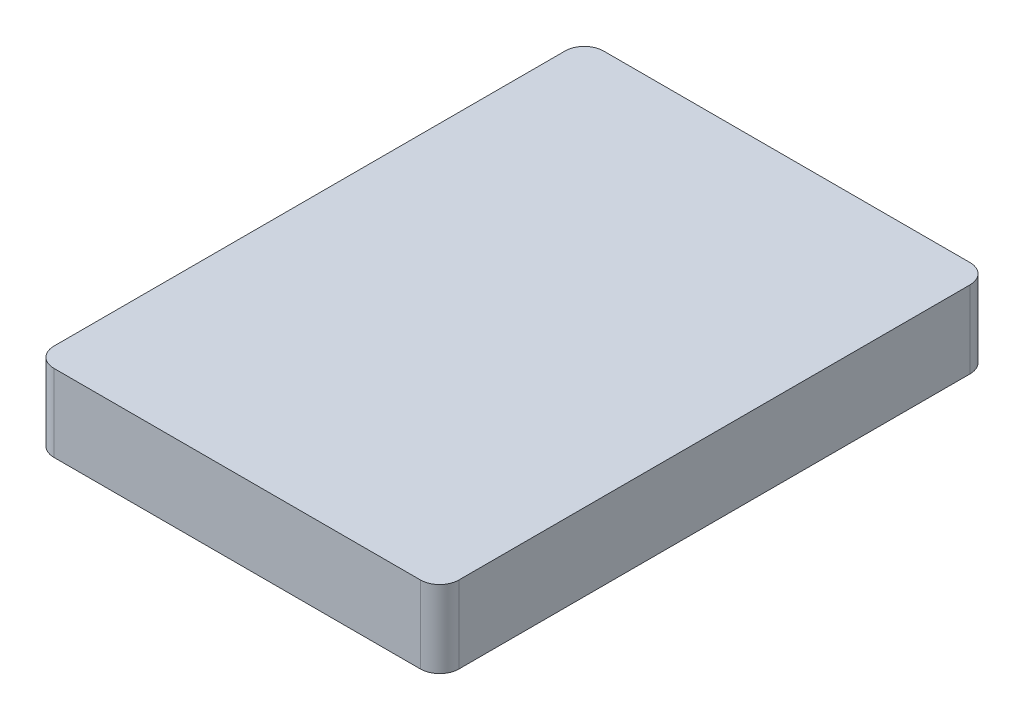
from build123d import *

# Parameters (mm, degrees)
SKETCH1_W           = 42
SKETCH1_H           = 57
BOSS_EXTRUDE1_DEPTH = 8
FILLET1_R           = 2


with BuildPart() as part:
    # Sketch1 → Boss-Extrude1 (new body)
    with BuildSketch(Plane(origin=(0, 0, 0), x_dir=(1, 0, 0), z_dir=(0, 1, 0))):
        with Locations((21, 28.5)):
            Rectangle(SKETCH1_W, SKETCH1_H)
    extrude(amount=BOSS_EXTRUDE1_DEPTH)

    # Fillet1
    fillet1_edges = [part.edges().sort_by_distance(p)[0] for p in [
        (0, 4, -57),
        (42, 4, -57),
        (42, 4, 0),
        (0, 4, 0),
    ]]
    fillet(fillet1_edges, radius=FILLET1_R)


solid = part.part
